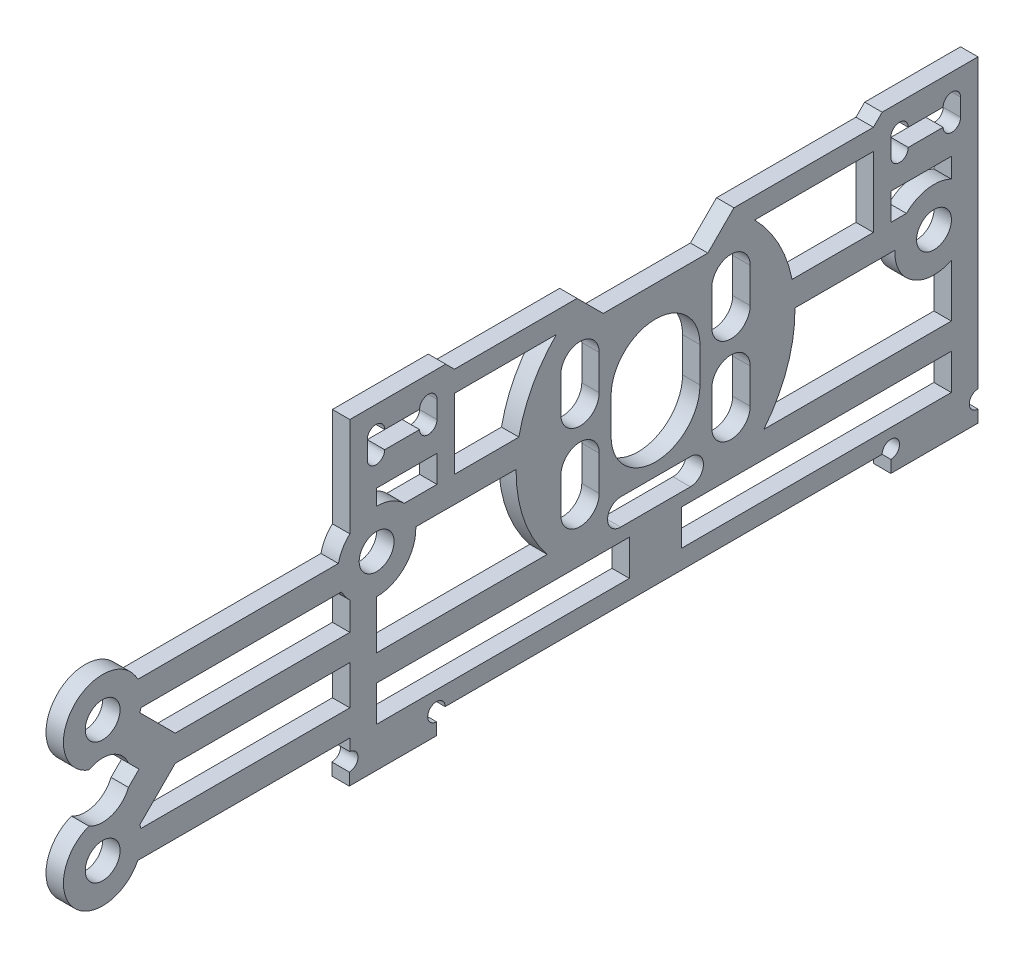
from build123d import *

# Parameters (mm, degrees)
SKETCH_1_R          = 1
EXTRUDE_1_DEPTH     = 1
CUT_EXTRUDE_START   = -1
SKETCH_2_W          = 14.5
SKETCH_2_H          = 2.048634766
SKETCH_2_W_2        = 15.468441373
CUT_EXTRUDE_1_DEPTH = 1


with BuildPart() as part:
    # 草图1 → 凸台-拉伸1 (new body)
    with BuildSketch(Plane(origin=(0, 0, 0), x_dir=(0, 0, -1), z_dir=(1, 0, 0))):
        with BuildLine():
            Line((35.439402333, 1.8), (35.439402333, 2.5))
            ThreePointArc((35.439402333, 2.5), (35.792955724, 3.353553391), (34.939402333, 3))
            Line((34.939402333, 3), (9.871490109, 3))
            ThreePointArc((9.871490109, 3), (9.017936719, 3.353553391), (9.371490109, 2.5))
            Line((9.371490109, 2.5), (9.371490109, 1.8))
            Line((9.371490109, 1.8), (4.371490109, 1.8))
            Line((4.371490109, 1.8), (4.371490109, 2.5))
            ThreePointArc((4.371490109, 2.5), (4.871240811, 2.984212798), (4.40304877, 3.499003057))
            Line((4.40304877, 3.499003057), (4.40304877, 4.175016197))
            Line((4.40304877, 4.175016197), (-7.761266908, 4.175016197))
            ThreePointArc((-7.761266908, 4.175016197), (-11.447420394, 3.667822703), (-10.564831187, 7.282516197))
            ThreePointArc((-10.564831187, 7.282516197), (-9.251899029, 7.163577788), (-8.295333824, 8.07072728))
            Line((-8.295333824, 8.07072728), (-7.691044908, 8.675016197))
            Line((-7.691044908, 8.675016197), (-8.295333824, 9.279305113))
            ThreePointArc((-8.295333824, 9.279305113), (-9.251899029, 10.186454606), (-10.564831187, 10.067516197))
            ThreePointArc((-10.564831187, 10.067516197), (-11.447420394, 13.682209691), (-7.761266908, 13.175016197))
            Line((-7.761266908, 13.175016197), (3.745661203, 13.175016197))
            ThreePointArc((3.745661203, 13.175016197), (3.988638874, 13.796186146), (4.40304877, 14.318828178))
            Line((4.40304877, 14.318828178), (4.40304877, 17.799978598))
            Line((4.40304877, 17.799978598), (4.40304877, 18.299978598))
            Line((4.40304877, 18.299978598), (4.40304877, 19.499978598))
            Line((4.40304877, 19.499978598), (4.40304877, 19.999978598))
            Line((4.40304877, 19.999978598), (9.90304877, 19.999978598))
            Line((9.90304877, 19.999978598), (10.40304877, 19.499978598))
            Line((10.40304877, 19.499978598), (17.439439899, 19.499978598))
            Line((17.439439899, 19.499978598), (18.9394023, 18.000016197))
            Line((18.9394023, 18.000016197), (21.9394023, 18.000016197))
            Line((21.9394023, 18.000016197), (24.9394023, 18.000016197))
            Line((24.9394023, 18.000016197), (26.439364701, 19.499978598))
            Line((26.439364701, 19.499978598), (34.439402333, 19.499978598))
            Line((34.439402333, 19.499978598), (34.939402333, 19.999978598))
            Line((34.939402333, 19.999978598), (40.439402333, 19.999978598))
            Line((40.439402333, 19.999978598), (40.439402333, 19.499978598))
            Line((40.439402333, 19.499978598), (40.439402333, 18.299978598))
            Line((40.439402333, 18.299978598), (40.439402333, 17.799978598))
            Line((40.439402333, 17.799978598), (40.439402333, 14.275016197))
            Line((40.439402333, 14.275016197), (40.439402333, 3.5))
            ThreePointArc((40.439402333, 3.5), (39.939402333, 3), (40.439402333, 2.5))
            Line((40.439402333, 2.5), (40.439402333, 1.8))
            Line((40.439402333, 1.8), (35.439402333, 1.8))
        make_face()
        with Locations((5.9394023, 12.675016197)):
            Circle(SKETCH_1_R, mode=Mode.SUBTRACT)
        with Locations((-9.776831345, 12.175016197)):
            Circle(SKETCH_1_R, mode=Mode.SUBTRACT)
        with Locations((-9.776831345, 5.175016197)):
            Circle(SKETCH_1_R, mode=Mode.SUBTRACT)
        with Locations((37.914877951, 12.675016197)):
            Circle(SKETCH_1_R, mode=Mode.SUBTRACT)
        with BuildLine():
            Line((19.3894023, 11.675016197), (19.3894023, 13.675016197))
            ThreePointArc((19.3894023, 13.675016197), (21.9394023, 16.225016197), (24.4894023, 13.675016197))
            Line((24.4894023, 13.675016197), (24.4894023, 11.675016197))
            ThreePointArc((24.4894023, 11.675016197), (21.9394023, 9.125016197), (19.3894023, 11.675016197))
        make_face(mode=Mode.SUBTRACT)
        with BuildLine():
            Line((27.369363454, 16.174920434), (27.369363454, 14.174920434))
            ThreePointArc((27.369363454, 14.174920434), (26.269363454, 13.074920434), (25.169363454, 14.174920434))
            Line((25.169363454, 14.174920434), (25.169363454, 16.174920434))
            ThreePointArc((25.169363454, 16.174920434), (26.269363454, 17.274920434), (27.369363454, 16.174920434))
        make_face(mode=Mode.SUBTRACT)
        with BuildLine():
            Line((16.510322262, 9.175620671), (16.510322262, 11.175620671))
            ThreePointArc((16.510322262, 11.175620671), (17.610322262, 12.275620671), (18.710322262, 11.175620671))
            Line((18.710322262, 11.175620671), (18.710322262, 9.175620671))
            ThreePointArc((18.710322262, 9.175620671), (17.610322262, 8.075620671), (16.510322262, 9.175620671))
        make_face(mode=Mode.SUBTRACT)
        with BuildLine():
            Line((27.368482338, 9.175620671), (27.368482338, 11.175620671))
            ThreePointArc((27.368482338, 11.175620671), (26.268482338, 12.275620671), (25.168482338, 11.175620671))
            Line((25.168482338, 11.175620671), (25.168482338, 9.175620671))
            ThreePointArc((25.168482338, 9.175620671), (26.268482338, 8.075620671), (27.368482338, 9.175620671))
        make_face(mode=Mode.SUBTRACT)
        with BuildLine():
            Line((16.509441146, 16.174920434), (16.509441146, 14.174920434))
            ThreePointArc((16.509441146, 14.174920434), (17.609441146, 13.074920434), (18.709441146, 14.174920434))
            Line((18.709441146, 14.174920434), (18.709441146, 16.174920434))
            ThreePointArc((18.709441146, 16.174920434), (17.609441146, 17.274920434), (16.509441146, 16.174920434))
        make_face(mode=Mode.SUBTRACT)
        with BuildLine():
            Line((10.40304877, 17.799978598), (10.40304877, 14.275016197))
            Line((10.40304877, 14.275016197), (14.101035123, 14.275016197))
            ThreePointArc((14.101035123, 14.275016197), (14.882875555, 16.44402539), (16.250834995, 18.299978598))
            Line((16.250834995, 18.299978598), (10.40304877, 18.299978598))
            Line((10.40304877, 18.299978598), (10.40304877, 17.799978598))
        make_face(mode=Mode.SUBTRACT)
        with BuildLine():
            Line((34.439402333, 17.799978598), (34.439402333, 14.275016197))
            Line((34.439402333, 14.275016197), (29.777769477, 14.275016197))
            ThreePointArc((29.777769477, 14.275016197), (28.995929045, 16.44402539), (27.627969606, 18.299978598))
            Line((27.627969606, 18.299978598), (34.439402333, 18.299978598))
            Line((34.439402333, 18.299978598), (34.439402333, 17.799978598))
        make_face(mode=Mode.SUBTRACT)
        with BuildLine():
            Line((36.439402333, 17.499978598), (38.439402333, 17.499978598))
            ThreePointArc((38.439402333, 17.499978598), (38.939402333, 16.999978598), (39.439402333, 17.499978598))
            Line((39.439402333, 17.499978598), (39.439402333, 18.499978598))
            ThreePointArc((39.439402333, 18.499978598), (38.939402333, 18.999978598), (38.439402333, 18.499978598))
            Line((38.439402333, 18.499978598), (36.439402333, 18.499978598))
            ThreePointArc((36.439402333, 18.499978598), (35.939402333, 18.999978598), (35.439402333, 18.499978598))
            Line((35.439402333, 18.499978598), (35.439402333, 17.499978598))
            ThreePointArc((35.439402333, 17.499978598), (35.939402333, 16.999978598), (36.439402333, 17.499978598))
        make_face(mode=Mode.SUBTRACT)
        with BuildLine():
            Line((6.40304877, 18.499978598), (8.40304877, 18.499978598))
            ThreePointArc((8.40304877, 18.499978598), (8.90304877, 18.999978598), (9.40304877, 18.499978598))
            Line((9.40304877, 18.499978598), (9.40304877, 17.499978598))
            ThreePointArc((9.40304877, 17.499978598), (8.90304877, 16.999978598), (8.40304877, 17.499978598))
            Line((8.40304877, 17.499978598), (6.40304877, 17.499978598))
            ThreePointArc((6.40304877, 17.499978598), (5.90304877, 16.999978598), (5.40304877, 17.499978598))
            Line((5.40304877, 17.499978598), (5.40304877, 18.499978598))
            ThreePointArc((5.40304877, 18.499978598), (5.90304877, 18.999978598), (6.40304877, 18.499978598))
        make_face(mode=Mode.SUBTRACT)
        with BuildLine():
            Line((3.923837863, 11.675016197), (-7.583090248, 11.675016197))
            ThreePointArc((-7.583090248, 11.675016197), (-7.611050301, 11.565186329), (-7.644505283, 11.456903696))
            Line((-7.644505283, 11.456903696), (-5.612617783, 9.425016197))
            Line((-5.612617783, 9.425016197), (4.40304877, 9.425016197))
            Line((4.40304877, 9.425016197), (4.40304877, 11.031204216))
            ThreePointArc((4.40304877, 11.031204216), (4.134505135, 11.331570544), (3.923837863, 11.675016197))
        make_face(mode=Mode.SUBTRACT)
        with BuildLine():
            Line((4.40304877, 5.675016197), (-7.583090248, 5.675016197))
            ThreePointArc((-7.583090248, 5.675016197), (-7.611050301, 5.784846064), (-7.644505283, 5.893128697))
            Line((-7.644505283, 5.893128697), (-5.612617783, 7.925016197))
            Line((-5.612617783, 7.925016197), (4.40304877, 7.925016197))
            Line((4.40304877, 7.925016197), (4.40304877, 5.675016197))
        make_face(mode=Mode.SUBTRACT)
    extrude(amount=EXTRUDE_1_DEPTH)

    # 草图2 → 切除-拉伸1 (cut)
    with BuildSketch(Plane(origin=(1, 0, 0), x_dir=(0, 0, -1), z_dir=(1, 0, 0)).offset(CUT_EXTRUDE_START)):
        with BuildLine():
            Line((13.939828478, 12.757591408), (9.40304877, 12.775016197))
            Line((9.40304877, 12.775016197), (8.18717898, 12.775016197))
            ThreePointArc((8.18717898, 12.775016197), (7.565363554, 11.119783095), (5.9394023, 10.425016197))
            Line((5.9394023, 10.425016197), (5.9394023, 7.637619031))
            Line((5.9394023, 7.637619031), (15.724530637, 7.637619031))
            ThreePointArc((15.724530637, 7.637619031), (14.385188615, 10.041794672), (13.939828478, 12.757591408))
        make_face()
        with BuildLine():
            Line((9.40304877, 15.823201902), (5.9394023, 15.823201902))
            Line((5.9394023, 15.823201902), (5.9394023, 14.925016197))
            ThreePointArc((5.9394023, 14.925016197), (6.794533869, 14.756181735), (7.521331502, 14.275016197))
            Line((7.521331502, 14.275016197), (9.40304877, 14.275016197))
            Line((9.40304877, 14.275016197), (9.40304877, 15.823201902))
        make_face()
        with Locations((13.1894023, 5.113301648)):
            Rectangle(SKETCH_2_W, SKETCH_2_H)
        with BuildLine():
            Line((38.907843673, 7.637619031), (38.907843673, 10.65597705))
            ThreePointArc((38.907843673, 10.65597705), (36.683529357, 10.791859103), (35.667101272, 12.775016197))
            Line((35.667101272, 12.775016197), (29.938777276, 12.775016197))
            ThreePointArc((29.938777276, 12.775016197), (29.4964794, 10.05002368), (28.154273964, 7.637619031))
            Line((28.154273964, 7.637619031), (38.907843673, 7.637619031))
        make_face()
        with Locations((31.173622986, 5.113301648)):
            Rectangle(SKETCH_2_W_2, SKETCH_2_H)
        with BuildLine():
            Line((38.907843673, 15.823201902), (35.439402333, 15.823201902))
            Line((35.439402333, 15.823201902), (35.439402333, 14.275016197))
            Line((35.439402333, 14.275016197), (36.332948749, 14.275016197))
            ThreePointArc((36.332948749, 14.275016197), (37.553466901, 14.895800304), (38.907843673, 14.694055343))
            Line((38.907843673, 14.694055343), (38.907843673, 15.823201902))
        make_face()
        with BuildLine():
            Line((19.9394023, 6.887619031), (23.9394023, 6.887619031))
            ThreePointArc((23.9394023, 6.887619031), (24.6894023, 7.637619031), (23.9394023, 8.387619031))
            Line((23.9394023, 8.387619031), (19.9394023, 8.387619031))
            ThreePointArc((19.9394023, 8.387619031), (19.1894023, 7.637619031), (19.9394023, 6.887619031))
        make_face()
    extrude(amount=CUT_EXTRUDE_1_DEPTH, mode=Mode.SUBTRACT)


solid = part.part
